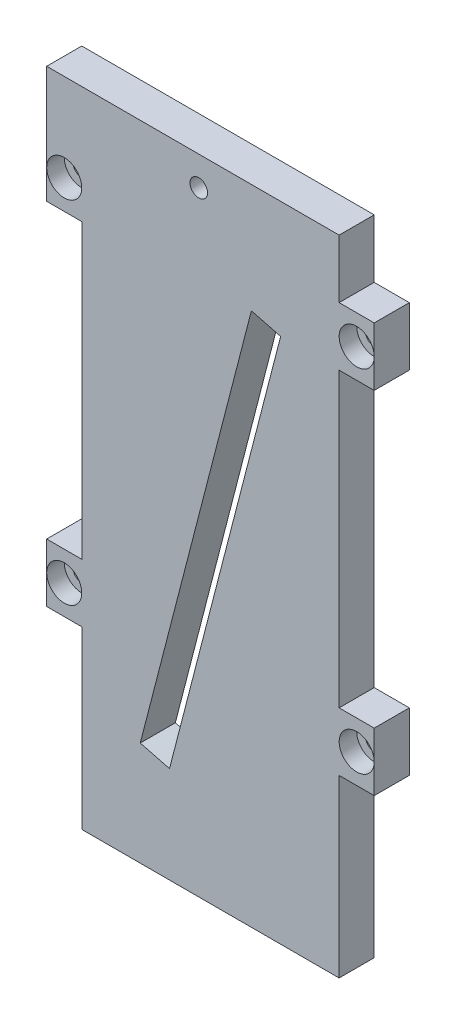
from build123d import *

# Parameters (mm, degrees)
BOSS_EXTRU_1_DEPTH      = 6
ESQUISSE2_R             = 1.5
ENL_V_MAT_EXTRU_1_DEPTH = 6
ESQUISSE6_R             = 1.5
ENL_V_MAT_EXTRU_4_DEPTH = 6
ESQUISSE7_R             = 2.995
ENL_V_MAT_EXTRU_5_DEPTH = 3
ESQUISSE8_W             = 44
ESQUISSE8_H             = 20
BOSS_EXTRU_2_DEPTH      = 6
ESQUISSE9_W             = 25
ESQUISSE9_H             = 6.5
ENL_V_MAT_EXTRU_6_DEPTH = 4
ENL_V_MAT_EXTRU_7_DEPTH = 6


with BuildPart() as part:
    # Esquisse1 → Boss.-Extru.1 (new body)
    with BuildSketch(Plane.XY):
        Polygon((-6, 70), (-6, 90), (44, 90), (44, 80), (50, 80), (50, 70), (44, 70), (44, 20), (50, 20), (50, 10), (44, 10), (44, 0), (0, 0), (0, 10), (-6, 10), (-6, 20), (0, 20), (0, 70), align=None)
    extrude(amount=BOSS_EXTRU_1_DEPTH)

    # Esquisse2 → Enlèv. mat.-Extru.1 (cut)
    with BuildSketch(Plane.XY.offset(6)):
        with Locations((20, 85)):
            Circle(ESQUISSE2_R)
    extrude(amount=-ENL_V_MAT_EXTRU_1_DEPTH, mode=Mode.SUBTRACT)

    # Esquisse6 → Enlèv. mat.-Extru.4 (cut)
    with BuildSketch(Plane.XY.offset(6)):
        with Locations((-3, 75)):
            Circle(ESQUISSE6_R)
        with Locations((-3, 15)):
            Circle(ESQUISSE6_R)
        with Locations(Location((47, 15, 0), (0, 0, 180))):
            Circle(ESQUISSE6_R)
        with Locations(Location((47, 75, 0), (0, 0, 180))):
            Circle(ESQUISSE6_R)
    extrude(amount=-ENL_V_MAT_EXTRU_4_DEPTH, mode=Mode.SUBTRACT)

    # Esquisse7 → Enlèv. mat.-Extru.5 (cut)
    with BuildSketch(Plane.XY.offset(6)):
        with Locations((-3, 15)):
            Circle(ESQUISSE7_R)
        with Locations((-3, 75)):
            Circle(ESQUISSE7_R)
        with Locations(Location((47, 75, 0), (0, 0, 180))):
            Circle(ESQUISSE7_R)
        with Locations(Location((47, 15, 0), (0, 0, 180))):
            Circle(ESQUISSE7_R)
    extrude(amount=-ENL_V_MAT_EXTRU_5_DEPTH, mode=Mode.SUBTRACT)

    # Esquisse8 → Boss.-Extru.2 (add)
    with BuildSketch(Plane(origin=(0, 0, 0), x_dir=(-1, 0, 0), z_dir=(0, 0, -1))):
        with Locations((-22, -10)):
            Rectangle(ESQUISSE8_W, ESQUISSE8_H)
    extrude(amount=-BOSS_EXTRU_2_DEPTH)

    # Esquisse9 → Enlèv. mat.-Extru.6 (cut)
    with BuildSketch(Plane(origin=(0, 0, 0), x_dir=(-1, 0, 0), z_dir=(0, 0, -1))):
        with Locations((-12.5, -9.75)):
            Rectangle(ESQUISSE9_W, ESQUISSE9_H)
    extrude(amount=-ENL_V_MAT_EXTRU_6_DEPTH, mode=Mode.SUBTRACT)

    # Esquisse10 → Enlèv. mat.-Extru.7 (cut)
    with BuildSketch(Plane(origin=(0, 0, 0), x_dir=(-1, 0, 0), z_dir=(0, 0, -1))):
        Polygon((-34, 70), (-15, -3.5), (-10, -2.207482993), (-29, 71.292517007), align=None)
    extrude(amount=-ENL_V_MAT_EXTRU_7_DEPTH, mode=Mode.SUBTRACT)


solid = part.part
